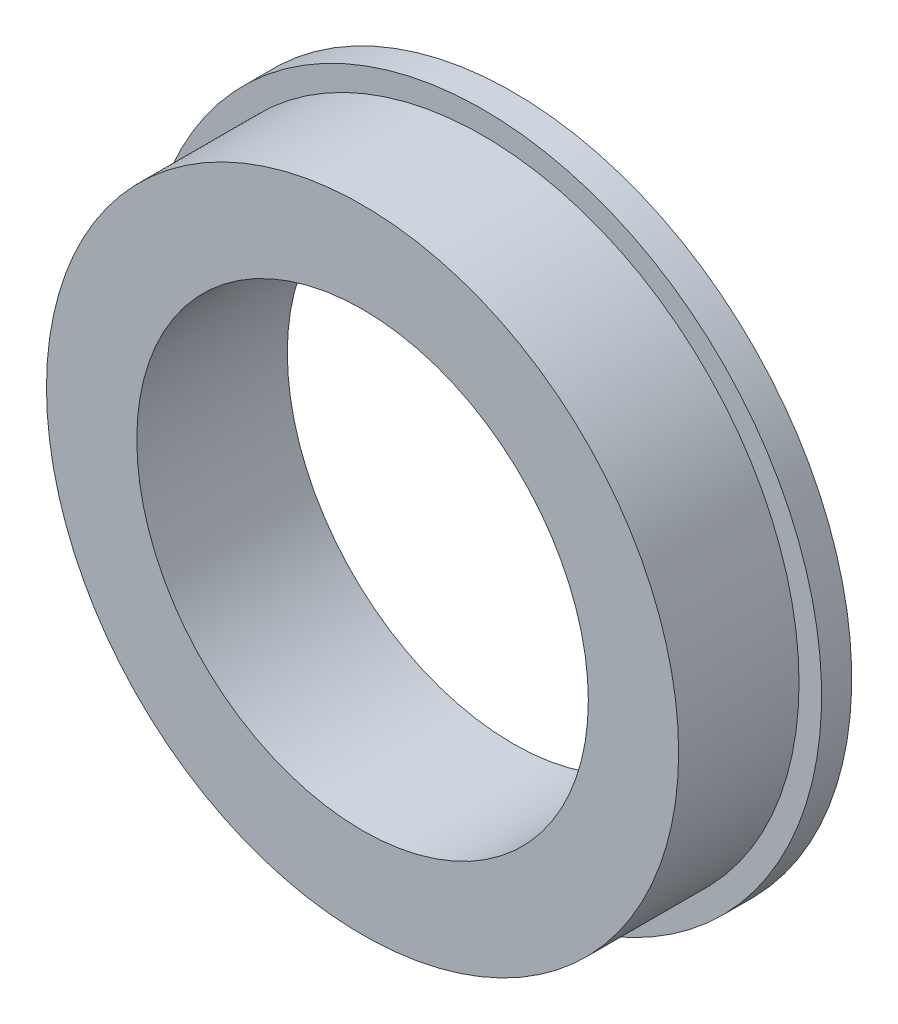
from build123d import *

# Parameters (mm, degrees)
SKETCH1_R           = 21
SKETCH1_R_2         = 15
BOSS_EXTRUDE1_DEPTH = 10
SKETCH6_R           = 22.5
BOSS_EXTRUDE2_DEPTH = 2
SKETCH7_R           = 15
CUT_EXTRUDE1_DEPTH  = 34.35416016


with BuildPart() as part:
    # Sketch1 → Boss-Extrude1 (new body)
    with BuildSketch(Plane.XY):
        Circle(SKETCH1_R)
        Circle(SKETCH1_R_2, mode=Mode.SUBTRACT)
    extrude(amount=BOSS_EXTRUDE1_DEPTH)

    # Sketch6 → Boss-Extrude2 (add)
    with BuildSketch(Plane(origin=(0, 0, 0), x_dir=(-1, 0, 0), z_dir=(0, 0, -1))):
        Circle(SKETCH6_R)
    extrude(amount=-BOSS_EXTRUDE2_DEPTH)

    # Sketch7 → Cut-Extrude1 (cut, through all)
    with BuildSketch(Plane.XY.offset(10)):
        Circle(SKETCH7_R)
    extrude(amount=-CUT_EXTRUDE1_DEPTH, mode=Mode.SUBTRACT)


solid = part.part
